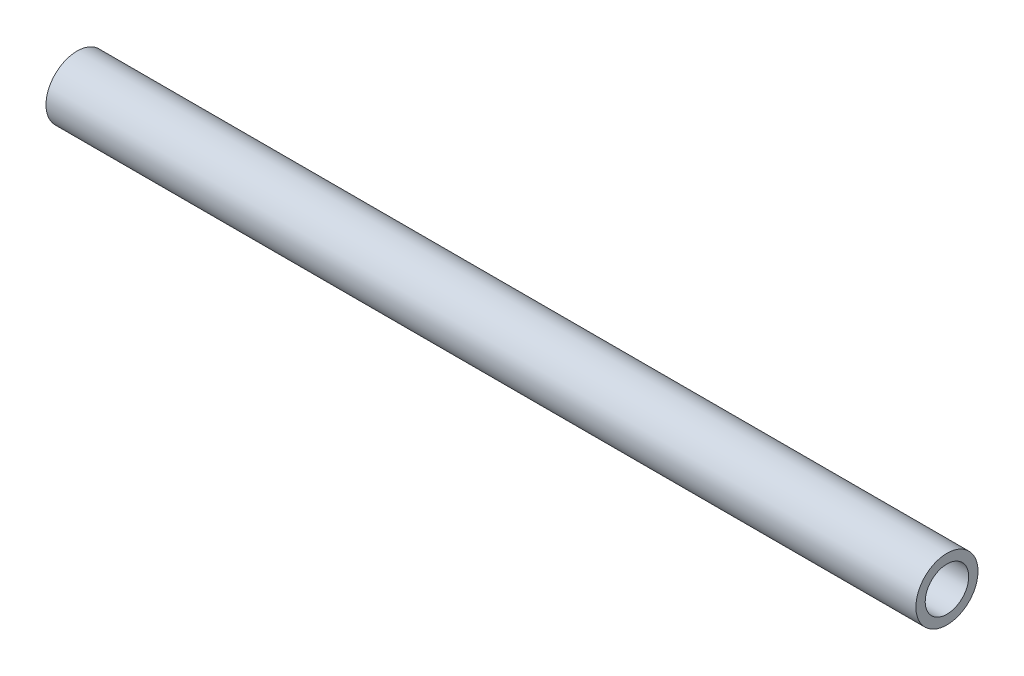
from build123d import *

# Parameters (mm, degrees)
SWEEP_THIN1_PROFILE_R   = 5
SWEEP_THIN1_PROFILE_R_2 = 3.5


with BuildPart() as part:
    # Sweep-Thin1: sweep along a path in Sketch1
    with BuildLine(Plane.XY) as sweep_thin1_path:
        Line((-70, 0), (70, 0))
    # Sweep-Thin1 profile (on start of the path) → Sweep-Thin1 (sweep)
    with BuildSketch(Plane.YZ.offset(-70)):
        Circle(SWEEP_THIN1_PROFILE_R)
        Circle(SWEEP_THIN1_PROFILE_R_2, mode=Mode.SUBTRACT)
    sweep(path=sweep_thin1_path.line)


solid = part.part
